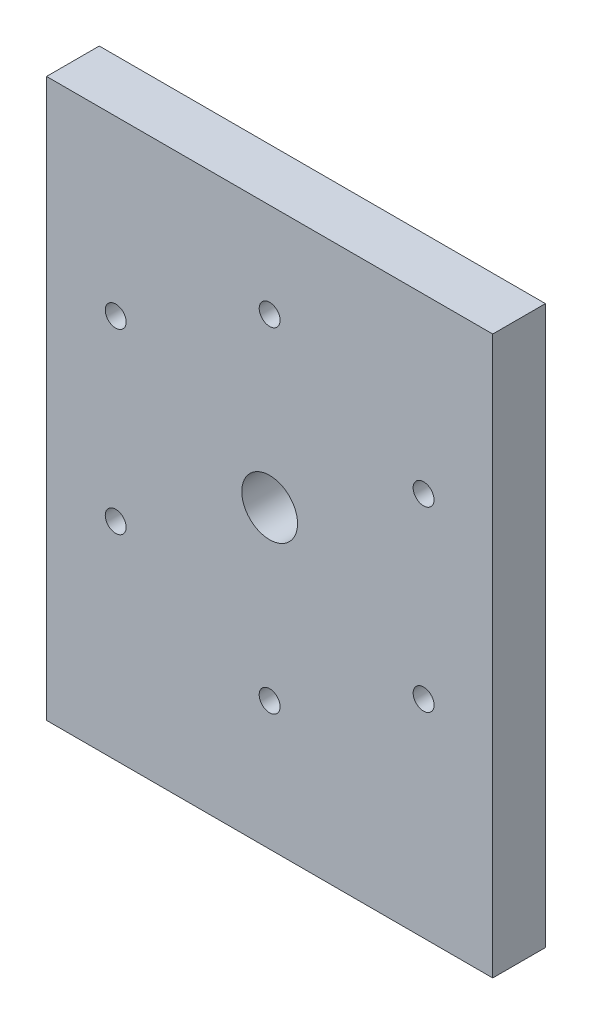
from build123d import *

# Parameters (mm, degrees)
SKETCH1_W                  = 101.6
SKETCH1_H                  = 127
SKETCH1_R                  = 6.35
BOSS_EXTRUDE1_DEPTH        = 12.0000014
SKETCH2_R                  = 2.38125
CUT_EXTRUDE1_DEPTH         = 138.308557758
SKETCH3_R                  = 1.27
CUT_EXTRUDE2_DEPTH         = 12.7
F_10_32_TAPPED_HOLE3_D     = 4.0386
F_10_32_TAPPED_HOLE3_DEPTH = 12.7
F_10_32_TAPPED_HOLE3_TIP   = 1.213317848


with BuildPart() as part:
    # Sketch1 → Boss-Extrude1 (new body)
    with BuildSketch(Plane.XY):
        with Locations((0, 63.5)):
            Rectangle(SKETCH1_W, SKETCH1_H)
        with Locations((0, 67.3749986)):
            Circle(SKETCH1_R, mode=Mode.SUBTRACT)
    extrude(amount=BOSS_EXTRUDE1_DEPTH)

    # Sketch2 → Cut-Extrude1 (cut, through all)
    with BuildSketch(Plane(origin=(0, 0, 0), x_dir=(-1, 0, 0), z_dir=(0, 0, -1))):
        with Locations((0, 105.4749986)):
            Circle(SKETCH2_R)
        with Locations((0, 29.2749986)):
            Circle(SKETCH2_R)
        with Locations((-35.057790877, 87.6156236)):
            Circle(SKETCH2_R)
        with Locations((-35.057790877, 47.1343736)):
            Circle(SKETCH2_R)
        with Locations((35.057790877, 47.1343736)):
            Circle(SKETCH2_R)
        with Locations((35.057790877, 87.6156236)):
            Circle(SKETCH2_R)
    extrude(amount=-CUT_EXTRUDE1_DEPTH, mode=Mode.SUBTRACT)

    # Sketch3 → Cut-Extrude2 (cut)
    with BuildSketch(Plane.XZ):
        with Locations(Location((31.75, 6.0000007, 0), (0, 0, 270))):
            Circle(SKETCH3_R)
        with Locations(Location((0, 6.0000007, 0), (0, 0, 270))):
            Circle(SKETCH3_R)
        with Locations(Location((-31.75, 6.0000007, 0), (0, 0, 270))):
            Circle(SKETCH3_R)
    extrude(amount=-CUT_EXTRUDE2_DEPTH, mode=Mode.SUBTRACT)

    # #10-32 Tapped Hole3
    with Locations(Plane(origin=(0, 0, 0), x_dir=(-1, 0, 0), z_dir=(0, -1, 0))):
        with Locations((-31.75, -6.0000007), (0, -6.0000007), (31.75, -6.0000007)):
            Hole(F_10_32_TAPPED_HOLE3_D / 2, depth=F_10_32_TAPPED_HOLE3_DEPTH)
            with Locations((0, 0, -(F_10_32_TAPPED_HOLE3_DEPTH + F_10_32_TAPPED_HOLE3_TIP / 2))):  # 118° drill point
                Cone(0, F_10_32_TAPPED_HOLE3_D / 2, F_10_32_TAPPED_HOLE3_TIP, mode=Mode.SUBTRACT)


solid = part.part
